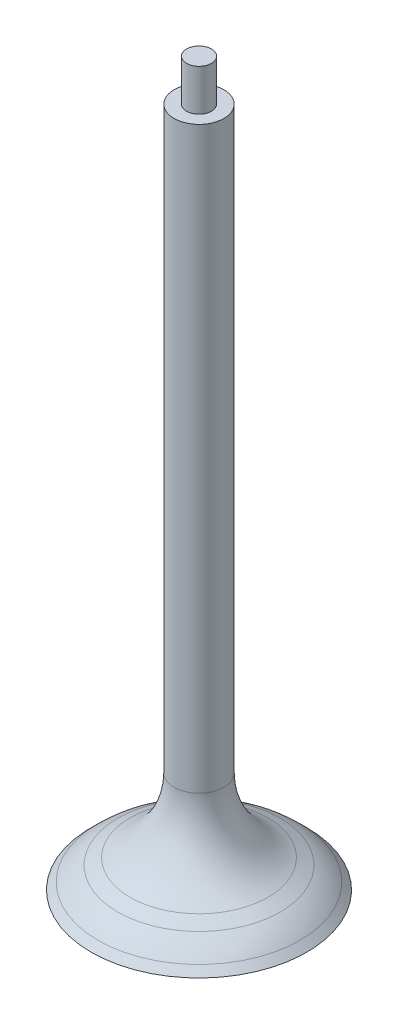
from build123d import *

# Parameters (mm, degrees)
FILLET1_R = 10
FILLET2_R = 10


with BuildPart() as part:
    # Sketch1 → Revolve1 (revolve)
    with BuildSketch(Plane.XY, mode=Mode.PRIVATE) as revolve1_sk:
        Polygon((0, 0), (0, 87), (1.5, 87), (1.5, 82), (3, 82), (3, 6.2), (11.114619975, 1.885380025), (13, 0), align=None)
    revolve(revolve1_sk.sketch.rotate(Axis((0, 0, 0), (0, 1, 0)), 90), axis=Axis((0, 0, 0), (0, 1, 0)))

    # Fillet1
    fillet1_edges = [part.edges().sort_by_distance(p)[0] for p in [
        (0, 6.2, 3),
    ]]
    fillet(fillet1_edges, radius=FILLET1_R)

    # Fillet2
    fillet2_edges = [part.edges().sort_by_distance(p)[0] for p in [
        (0, 1.885380025, 11.114619975),
    ]]
    fillet(fillet2_edges, radius=FILLET2_R)


solid = part.part
